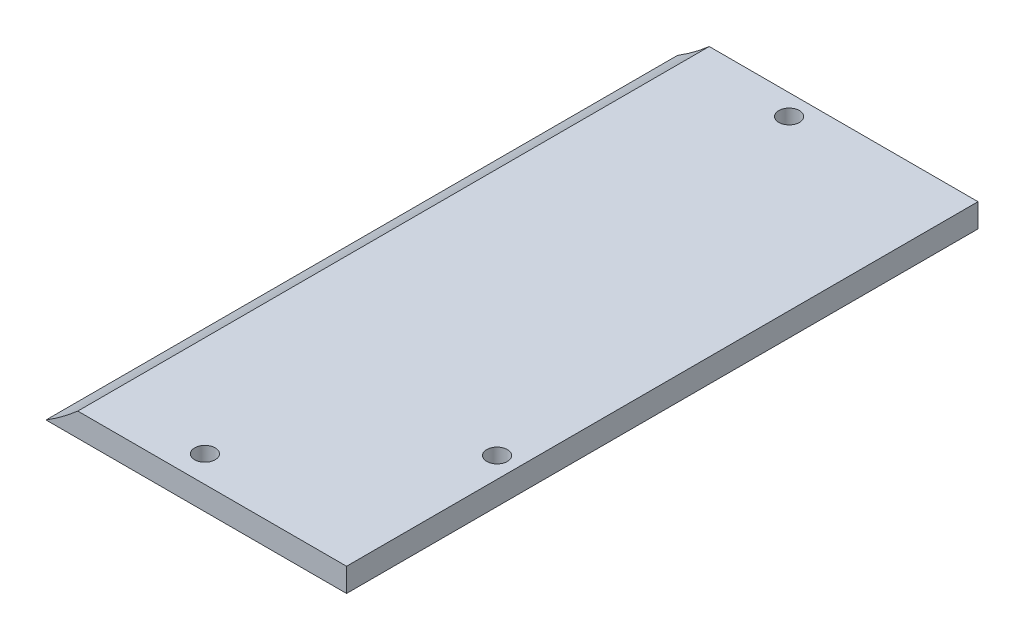
from build123d import *
from build123d.topology import SkipClean

# Parameters (mm, degrees)
SKETCH1_R                      = 40
SKETCH1_R_2                    = 38
BOSS_EXTRUDE1_DEPTH            = 200
SKETCH2_R                      = 40
BOSS_EXTRUDE2_DEPTH            = 2
BOSS_EXTRUDE3_DEPTH            = 107
BOSS_EXTRUDE4_DEPTH            = 2
SKETCH5_R                      = 1.75
CUT_EXTRUDE1_DEPTH             = 226.077764339
CUT_EXTRUDE2_REACH             = 218.296
SKETCH6_R                      = 4
CUT_EXTRUDE2_DIRECTION_2_REACH = 218.296
CIRPATTERN1_COUNT              = 2
CIRPATTERN1_ANGLE              = 90
BOSS_EXTRUDE5_REACH            = 241.742
BOSS_EXTRUDE5_END_RADIUS       = 40
SKETCH7_W                      = 14
SKETCH7_H                      = 2
CUT_EXTRUDE3_REACH             = 221.073
SKETCH8_R                      = 1.75
FILLET1_R                      = 3
CUT_EXTRUDE4_REACH             = 220.598
SKETCH9_R                      = 0.25
BOSS_EXTRUDE6_START            = 2
BOSS_EXTRUDE6_DEPTH            = 2
CUT_EXTRUDE5_REACH             = 220.147
CUT_EXTRUDE6_DEPTH             = 2


with BuildPart() as part:
    # Sketch1 → Boss-Extrude1 (new body)
    with BuildSketch(Plane.XY):
        Circle(SKETCH1_R)
        Circle(SKETCH1_R_2, mode=Mode.SUBTRACT)
    extrude(amount=BOSS_EXTRUDE1_DEPTH)

    # Sketch2 → Boss-Extrude2 (add)
    with BuildSketch(Plane.XY.offset(180)):
        Circle(SKETCH2_R)
    extrude(amount=BOSS_EXTRUDE2_DEPTH)

    # Sketch3 → Boss-Extrude3 (add)
    with BuildSketch(Plane(origin=(0, 0, 0), x_dir=(-1, 0, 0), z_dir=(0, 0, -1))):
        with BuildLine():
            Line((-21.071307506, -34), (-72, -34))
            Line((-72, -34), (-72, -30))
            Line((-72, -30), (-26.457513111, -30))
            ThreePointArc((-26.457513111, -30), (-23.848421275, -32.113125085), (-21.071307506, -34))
        make_face()
        with BuildLine():
            Line((-21.071307506, 34), (-72, 34))
            Line((-72, 34), (-72, 30))
            Line((-72, 30), (-26.457513111, 30))
            ThreePointArc((-26.457513111, 30), (-23.848421275, 32.113125085), (-21.071307506, 34))
        make_face()
    extrude(amount=-BOSS_EXTRUDE3_DEPTH)

    # Sketch4 → Boss-Extrude4 (add)
    with BuildSketch(Plane.XY.offset(107)):
        with BuildLine():
            Line((72, -34), (21.071307506, -34))
            ThreePointArc((21.071307506, -34), (40, 0), (21.071307506, 34))
            Line((21.071307506, 34), (72, 34))
            Line((72, 34), (72, -34))
        make_face()
    extrude(amount=BOSS_EXTRUDE4_DEPTH)

    # Sketch5 → Cut-Extrude1 (cut, through all)
    with BuildSketch(Plane(origin=(0, 34, 0), x_dir=(1, 0, 0), z_dir=(0, 1, 0))):
        with Locations(Location((43.5, -102.5, 0), (0, 0, 270))):
            Circle(SKETCH5_R)
        with Locations(Location((43.5, -3.5, 0), (0, 0, 270))):
            Circle(SKETCH5_R)
        with Locations(Location((68.5, -78, 0), (0, 0, 270))):
            Circle(SKETCH5_R)
    extrude(amount=-CUT_EXTRUDE1_DEPTH, mode=Mode.SUBTRACT)

    # Sketch6 → Cut-Extrude2 (cut, up to next)
    with BuildSketch(Plane(origin=(0, 0, 0), x_dir=(0, 0, 1), z_dir=(-0.7071067811865488, 0.7071067811865464, 0)), mode=Mode.PRIVATE) as cut_extrude2_sk1:
        with Locations(Location((187, 0, 0), (0, 0, 90))):
            Circle(SKETCH6_R)
    cut_extrude2_tool1 = extrude(cut_extrude2_sk1.sketch, amount=-CUT_EXTRUDE2_REACH, mode=Mode.PRIVATE) & part.part
    cut_extrude2 = cut_extrude2_tool1.solids().sort_by_distance((0, 0, 187))[0]
    add(cut_extrude2, mode=Mode.SUBTRACT)

    # Sketch6 → Cut-Extrude2 direction 2 (cut, up to next)
    with BuildSketch(Plane(origin=(0, 0, 0), x_dir=(0, 0, 1), z_dir=(-0.7071067811865488, 0.7071067811865464, 0)), mode=Mode.PRIVATE) as cut_extrude2_direction_2_sk1:
        with Locations(Location((187, 0, 0), (0, 0, 90))):
            Circle(SKETCH6_R)
    cut_extrude2_direction_2_tool1 = extrude(cut_extrude2_direction_2_sk1.sketch, amount=CUT_EXTRUDE2_DIRECTION_2_REACH, mode=Mode.PRIVATE) & part.part
    cut_extrude2_direction_2 = cut_extrude2_direction_2_tool1.solids().sort_by_distance((0, 0, 187))[0]
    add(cut_extrude2_direction_2, mode=Mode.SUBTRACT)

    # CirPattern1: Cut-Extrude2, Cut-Extrude2 direction 2 ×2 about axis
    cirpattern1_axis = Axis((0, 0, -5.35), (0, 0, 1))
    add([cut_extrude2.rotate(cirpattern1_axis, i * CIRPATTERN1_ANGLE / (CIRPATTERN1_COUNT - 1)) for i in range(1, CIRPATTERN1_COUNT)], mode=Mode.SUBTRACT)
    add([cut_extrude2_direction_2.rotate(cirpattern1_axis, i * CIRPATTERN1_ANGLE / (CIRPATTERN1_COUNT - 1)) for i in range(1, CIRPATTERN1_COUNT)], mode=Mode.SUBTRACT)

    # Boss-Extrude5: up to this cylinder (the profile starts outside it)
    boss_extrude5_end = Plane(origin=(0, 0, 7), z_dir=(0, 0, -1)) * Cylinder(BOSS_EXTRUDE5_END_RADIUS, 564.484, mode=Mode.PRIVATE)
    # Sketch7 → Boss-Extrude5 (add, up to the surface)
    with BuildSketch(Plane(origin=(-54, 0, 0), x_dir=(0, 0, -1), z_dir=(1, 0, 0)), mode=Mode.PRIVATE) as boss_extrude5_sk1:
        with Locations((-7, -12)):
            Rectangle(SKETCH7_W, SKETCH7_H)
    boss_extrude5_tool1 = extrude(boss_extrude5_sk1.sketch, amount=BOSS_EXTRUDE5_REACH, mode=Mode.PRIVATE) - boss_extrude5_end
    add(boss_extrude5_tool1.solids().sort_by_distance((-54, -12, 7))[0])
    # Sketch7 → Boss-Extrude5 (add, up to the surface)
    with BuildSketch(Plane(origin=(-54, 0, 0), x_dir=(0, 0, -1), z_dir=(1, 0, 0)), mode=Mode.PRIVATE) as boss_extrude5_sk2:
        with Locations((-7, 12)):
            Rectangle(SKETCH7_W, SKETCH7_H)
    boss_extrude5_tool2 = extrude(boss_extrude5_sk2.sketch, amount=BOSS_EXTRUDE5_REACH, mode=Mode.PRIVATE) - boss_extrude5_end
    add(boss_extrude5_tool2.solids().sort_by_distance((-54, 12, 7))[0])

    # Cut-Extrude3: up to this face of the body (flat: up to its plane)
    cut_extrude3_end = Plane(part.part.faces().sort_by_distance((-45.914280319, 13, 7))[0])
    # Sketch8 → Cut-Extrude3 (cut, up to the picked face)
    with BuildSketch(Plane.XZ.offset(13), mode=Mode.PRIVATE) as cut_extrude3_sk1:
        with Locations(Location((-49.770305539, 5.008755099, 0), (0, 0, 270))):
            Circle(SKETCH8_R)
    cut_extrude3_tool1 = split(extrude(cut_extrude3_sk1.sketch, amount=-CUT_EXTRUDE3_REACH, mode=Mode.PRIVATE), bisect_by=cut_extrude3_end, keep=Keep.BOTH, mode=Mode.PRIVATE)
    add(cut_extrude3_tool1.solids().sort_by(Axis((-49.770306, -13, 5.008755), (0, 1, 0)))[0], mode=Mode.SUBTRACT)

    # Fillet1
    fillet1_edges = [part.edges().sort_by_distance(p)[0] for p in [
        (-54, -12, 14),
        (-54, -12, 0),
        (-54, 12, 0),
        (-54, 12, 14),
    ]]
    fillet(fillet1_edges, radius=FILLET1_R)

    # Sketch9 → Cut-Extrude4 (cut, up to next)
    with BuildSketch(Plane.XZ.offset(-11), mode=Mode.PRIVATE) as cut_extrude4_sk1:
        with Locations(Location((-43.770305539, 7.008755099, 0), (0, 0, 270))):
            Circle(SKETCH9_R)
    cut_extrude4_tool1 = extrude(cut_extrude4_sk1.sketch, amount=-CUT_EXTRUDE4_REACH, mode=Mode.PRIVATE) & part.part
    add(cut_extrude4_tool1.solids().sort_by_distance((-43.770306, 11, 7.008755))[0], mode=Mode.SUBTRACT)

    # Sketch10 → Boss-Extrude6 (add)
    with SkipClean():  # the faces are left unmerged after this step: merging them gives an invalid solid
        with BuildSketch(Plane(origin=(0, 0, 0), x_dir=(-1, 0, 0), z_dir=(0, 0, -1)).offset(BOSS_EXTRUDE6_START)):
            with BuildLine():
                ThreePointArc((10, -36.66060556), (0, -38), (-10, -36.66060556))
                Line((-10, -36.66060556), (-10, -38.729833462))
                ThreePointArc((-10, -38.729833462), (0, -40), (10, -38.729833462))
                Line((10, -38.729833462), (10, -36.66060556))
            make_face()
            with BuildLine():
                ThreePointArc((10, 38.729833462), (0, 40), (-10, 38.729833462))
                Line((-10, 38.729833462), (-10, 36.66060556))
                ThreePointArc((-10, 36.66060556), (0, 38), (10, 36.66060556))
                Line((10, 36.66060556), (10, 38.729833462))
            make_face()
        extrude(amount=-BOSS_EXTRUDE6_DEPTH)

    # Sketch11 → Cut-Extrude5 (cut, up to next)
    with BuildSketch(Plane.XY.offset(200), mode=Mode.PRIVATE) as cut_extrude5_sk1:
        with BuildLine():
            Line((72, -30), (26.457513111, -30))
            ThreePointArc((26.457513111, -30), (4.885813731, -39.700488967), (-18.394203397, -35.519759028))
            ThreePointArc((-18.394203397, -35.519759028), (-67.547618815, 11.421275725), (-5.693831608, 39.592679647))
            ThreePointArc((-5.693831608, 39.592679647), (8.181455106, 39.154358536), (21.071307506, 34))
            Line((21.071307506, 34), (72, 34))
            Line((72, 34), (72, -30))
        make_face()
    cut_extrude5_tool1 = extrude(cut_extrude5_sk1.sketch, amount=-CUT_EXTRUDE5_REACH, mode=Mode.PRIVATE) & part.part
    add(cut_extrude5_tool1.solids().sort_by_distance((2.161128, 2.460349, 200))[0], mode=Mode.SUBTRACT)

    # Sketch12 → Cut-Extrude6 (cut)
    with BuildSketch(Plane.XY.offset(109)):
        with BuildLine():
            Line((72, -30), (26.457513111, -30))
            ThreePointArc((26.457513111, -30), (23.848421275, -32.113125085), (21.071307506, -34))
            Line((21.071307506, -34), (72, -34))
            Line((72, -34), (72, -30))
        make_face()
    extrude(amount=-CUT_EXTRUDE6_DEPTH, mode=Mode.SUBTRACT)


solid = part.part
